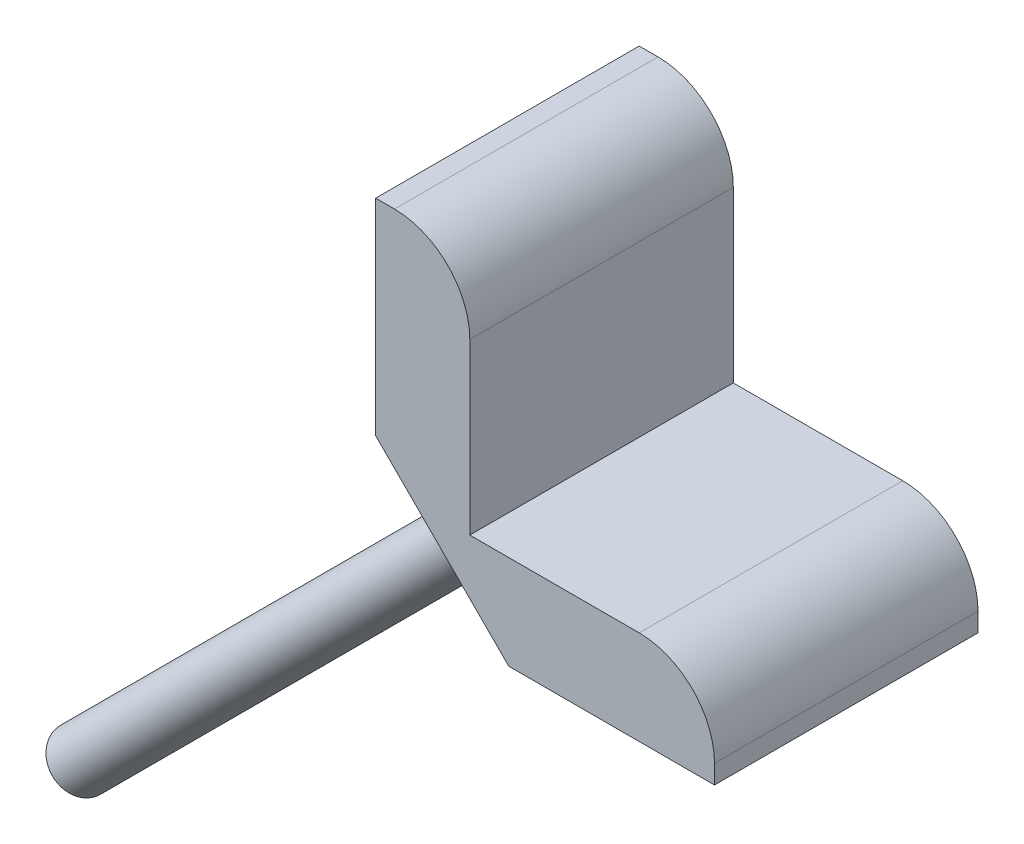
from build123d import *

# Parameters (mm, degrees)
SKETCH1_W           = 90
SKETCH1_H           = 80
BOSS_EXTRUDE1_DEPTH = 90
SKETCH2_W           = 65
SKETCH2_H           = 65
CUT_EXTRUDE1_DEPTH  = 100
FILLET1_R           = 20
CUT_EXTRUDE2_DEPTH  = 100
SKETCH4_R           = 7.5
BOSS_EXTRUDE2_DEPTH = 150
SKETCH6_W           = 10
SKETCH6_H           = 127.279220614
CUT_EXTRUDE4_DEPTH  = 212.224744882


with BuildPart() as part:
    # Sketch1 → Boss-Extrude1 (new body)
    with BuildSketch(Plane(origin=(0, 0, 0), x_dir=(1, 0, 0), z_dir=(0, 1, 0))):
        with Locations((-45, 40)):
            Rectangle(SKETCH1_W, SKETCH1_H)
    extrude(amount=BOSS_EXTRUDE1_DEPTH)

    # Sketch2 → Cut-Extrude1 (cut)
    with BuildSketch(Plane(origin=(0, 0, -80), x_dir=(-1, 0, 0), z_dir=(0, 0, -1))):
        with Locations((32.5, 57.5)):
            Rectangle(SKETCH2_W, SKETCH2_H)
    extrude(amount=-CUT_EXTRUDE1_DEPTH, mode=Mode.SUBTRACT)

    # Fillet1
    fillet1_edges = [part.edges().sort_by_distance(p)[0] for p in [
        (-65, 90, -40),
        (0, 25, -40),
    ]]
    fillet(fillet1_edges, radius=FILLET1_R)

    # Sketch3 → Cut-Extrude2 (cut)
    with BuildSketch(Plane(origin=(0, 0, -80), x_dir=(-1, 0, 0), z_dir=(0, 0, -1))):
        Polygon((54.644660941, 0), (90, 35.355339059), (90, 0), align=None)
    extrude(amount=-CUT_EXTRUDE2_DEPTH, mode=Mode.SUBTRACT)

    # Sketch4 → Boss-Extrude2 (add)
    with BuildSketch(Plane(origin=(-27.32233047, -27.32233047, 0), x_dir=(0, 0, 1), z_dir=(-0.7071067811865477, -0.7071067811865475, 0))):
        with Locations(Location((-60, 63.639610307, 0), (0, 0, 90))):
            Circle(SKETCH4_R)
        with Locations(Location((-20, 63.639610307, 0), (0, 0, 90))):
            Circle(SKETCH4_R)
    extrude(amount=BOSS_EXTRUDE2_DEPTH)

    # Sketch6 → Cut-Extrude4 (cut, through all)
    with BuildSketch(Plane(origin=(-27.32233047, -27.32233047, 0), x_dir=(0, 0, 1), z_dir=(-0.7071067811865477, -0.7071067811865475, 0))):
        with Locations((-5, 63.639610307)):
            Rectangle(SKETCH6_W, SKETCH6_H)
    extrude(amount=-CUT_EXTRUDE4_DEPTH, mode=Mode.SUBTRACT)


solid = part.part
